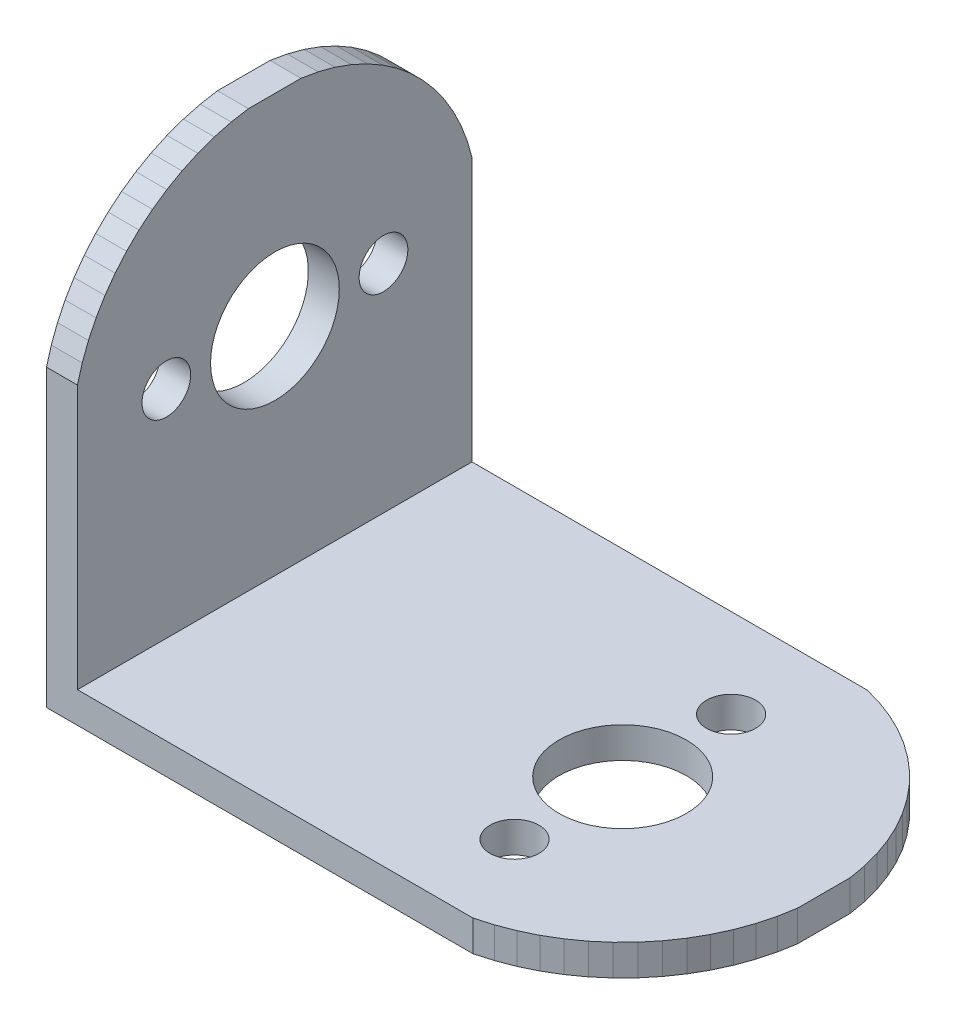
from build123d import *

# Parameters (mm, degrees)
SALIENTE_EXTRUIR1_DEPTH = 2.000000328
CROQUIS2_W              = 2.000000328
CROQUIS2_H              = 25.499995797
SALIENTE_EXTRUIR2_DEPTH = 17.052894691
SALIENTE_EXTRUIR3_DEPTH = 2.000000095
CORTAR_EXTRUIR1_DEPTH   = 92.062133489
CORTAR_EXTRUIR2_DEPTH   = 92.062133489
CORTAR_EXTRUIR3_DEPTH   = 85.413414633
CORTAR_EXTRUIR4_DEPTH   = 85.413414633
CORTAR_EXTRUIR5_DEPTH   = 85.413414633
CORTAR_EXTRUIR6_DEPTH   = 91.256922872
CROQUIS10_R             = 4.160635969
CROQUIS10_R_2           = 1.574242088
CORTAR_EXTRUIR7_DEPTH   = 92.062133489
CROQUIS11_R             = 4.116064073
CROQUIS11_R_2           = 1.582596422
CORTAR_EXTRUIR8_DEPTH   = 86.074229775


with BuildPart() as part:
    # Croquis1 → Saliente-Extruir1 (new body)
    with BuildSketch(Plane(origin=(-18.750000745, 0, 0), x_dir=(0, -1, 0), z_dir=(-1, 0, 0))):
        Polygon((-19.052894786, -77.749997377), (-19.052894786, -52.25000158), (-20.138457417, -52.559908479), (-21.193336695, -52.962061018), (-22.209705785, -53.453475237), (-23.180030286, -54.030507803), (-24.097116664, -54.688870907), (-24.954162538, -55.423695594), (-25.744814426, -56.229524314), (-26.46320872, -57.100389153), (-27.104021981, -58.029823005), (-27.662498876, -59.010945261), (-28.134498745, -60.036472976), (-28.51652354, -61.098802835), (-28.805738315, -62.190063298), (-28.999999166, -63.302159309), (-28.999999166, -66.697835922), (-28.805738315, -67.809939384), (-28.51652354, -68.901196122), (-28.134498745, -69.963529706), (-27.662498876, -70.989057422), (-27.104021981, -71.970179677), (-26.46320872, -72.899609804), (-25.744814426, -73.770478368), (-24.954162538, -74.576310813), (-24.097116664, -75.311124325), (-23.180030286, -75.969494879), (-22.209705785, -76.546527445), (-21.193336695, -77.037930489), (-20.138457417, -77.440083027), align=None)
    extrude(amount=-SALIENTE_EXTRUIR1_DEPTH)

    # Croquis2 → Saliente-Extruir2 (add)
    with BuildSketch(Plane.XZ.offset(-19.052894786)):
        with Locations((-17.750000581, -64.999999479)):
            Rectangle(CROQUIS2_W, CROQUIS2_H)
    extrude(amount=SALIENTE_EXTRUIR2_DEPTH)

    # Croquis3 → Saliente-Extruir3 (add)
    with BuildSketch(Plane.XZ.offset(-2.000000095)):
        Polygon((8.802894503, -77.749997377), (-18.750000745, -77.749997377), (-18.750000745, -52.25000158), (8.802894503, -52.25000158), (9.888458066, -52.559908479), (10.943335481, -52.962061018), (11.959705502, -53.453475237), (12.930030003, -54.030507803), (13.84711545, -54.688870907), (14.704162255, -55.423695594), (15.494815074, -56.229524314), (16.213208437, -57.100389153), (16.854021698, -58.029823005), (17.412498593, -59.010945261), (17.884498462, -60.036472976), (18.266523257, -61.098802835), (18.555738032, -62.190063298), (18.750000745, -63.302159309), (18.750000745, -66.697835922), (18.555738032, -67.809939384), (18.266523257, -68.901196122), (17.884498462, -69.963529706), (17.412498593, -70.989057422), (16.854021698, -71.970179677), (16.213208437, -72.899609804), (15.494815074, -73.770478368), (14.704162255, -74.576310813), (13.84711545, -75.311124325), (12.930030003, -75.969494879), (11.959705502, -76.546527445), (10.943335481, -77.037930489), (9.888458066, -77.440083027), align=None)
    extrude(amount=SALIENTE_EXTRUIR3_DEPTH)

    # Croquis4 → Cortar-Extruir1 (cut, through all)
    with BuildSketch(Plane.ZY.offset(18.750000745)):
        Polygon((-67.884810269, 13.229101896), (-67.402966321, 12.802229263), (-66.858895123, 12.458175421), (-66.266670823, 12.205854058), (-65.641649067, 12.051798403), (-64.999997616, 12.000000104), (-64.358353615, 12.051798403), (-63.733331859, 12.205854058), (-63.141107559, 12.458175421), (-62.597028911, 12.802229263), (-62.115188688, 13.229101896), (-61.708066612, 13.727741316), (-61.386201531, 14.285230078), (-61.157926917, 14.887129888), (-61.029162258, 15.517854132), (-61.003241688, 16.161063686), (-61.08083576, 16.800101846), (-61.259932816, 17.41841808), (-61.535898596, 17.999999225), (-61.901580542, 18.529782072), (-62.347508967, 18.99404265), (-62.86213547, 19.380759448), (-63.432134688, 19.679918885), (-64.04273957, 19.883768633), (-64.678132534, 19.987029955), (-65.321870148, 19.987029955), (-65.957263112, 19.883768633), (-66.567860544, 19.679918885), (-67.137859762, 19.380759448), (-67.652486265, 18.99404265), (-68.098418415, 18.529782072), (-68.464100361, 17.999999225), (-68.740069866, 17.41841808), (-68.919159472, 16.800101846), (-68.996757269, 16.161063686), (-68.970829248, 15.517854132), (-68.842068315, 14.887129888), (-68.613797426, 14.285230078), (-68.291939795, 13.727741316), align=None)
    extrude(amount=-CORTAR_EXTRUIR1_DEPTH, mode=Mode.SUBTRACT)

    # Croquis5 → Cortar-Extruir2 (cut, through all)
    with BuildSketch(Plane.ZY.offset(18.750000745)):
        Polygon((-57.250000536, 14.700962231), (-56.939337403, 14.939339831), (-56.700963527, 15.250000171), (-56.551113725, 15.611771494), (-56.499999017, 16.00000076), (-56.551113725, 16.388230026), (-56.700963527, 16.750000417), (-56.939337403, 17.060659826), (-57.250000536, 17.299037427), (-57.611770928, 17.448889092), (-57.999998331, 17.500000075), (-58.38822946, 17.448889092), (-58.749999851, 17.299037427), (-59.060662985, 17.060659826), (-59.29903686, 16.750000417), (-59.448886663, 16.388230026), (-59.500001371, 16.00000076), (-59.448886663, 15.611771494), (-59.29903686, 15.250000171), (-59.060662985, 14.939339831), (-58.749999851, 14.700962231), (-58.38822946, 14.551111497), (-57.999998331, 14.499999583), (-57.611770928, 14.551111497), align=None)
    extrude(amount=-CORTAR_EXTRUIR2_DEPTH, mode=Mode.SUBTRACT)

    # Croquis6 → Cortar-Extruir3 (cut, through all)
    with BuildSketch(Plane(origin=(0, 2.000000095, 0), x_dir=(-1, 0, 0), z_dir=(0, 1, 0))):
        Polygon((-4.450961947, -57.250000536), (-4.689339548, -56.939337403), (-4.999999888, -56.700963527), (-5.361771677, -56.551113725), (-5.750000011, -56.499999017), (-6.138228346, -56.551113725), (-6.500000134, -56.700963527), (-6.810660474, -56.939337403), (-7.049038075, -57.250000536), (-7.198888808, -57.611770928), (-7.249999791, -57.999998331), (-7.198888808, -58.38822946), (-7.049038075, -58.749999851), (-6.810660474, -59.060662985), (-6.500000134, -59.29903686), (-6.138228346, -59.448886663), (-5.750000011, -59.500001371), (-5.361771677, -59.448886663), (-4.999999888, -59.29903686), (-4.689339548, -59.060662985), (-4.450961947, -58.749999851), (-4.301111214, -58.38822946), (-4.250000231, -57.999998331), (-4.301111214, -57.611770928), align=None)
    extrude(amount=-CORTAR_EXTRUIR3_DEPTH, mode=Mode.SUBTRACT)

    # Croquis7 → Cortar-Extruir4 (cut, through all)
    with BuildSketch(Plane(origin=(0, 2.000000095, 0), x_dir=(-1, 0, 0), z_dir=(0, 1, 0))):
        Polygon((-5.750000011, -73.49999994), (-5.361771677, -73.448888958), (-4.999999888, -73.299042881), (-4.689339548, -73.060661554), (-4.450961947, -72.750002146), (-4.301111214, -72.388231754), (-4.250000231, -71.999996901), (-4.301111214, -71.611769497), (-4.450961947, -71.249999106), (-4.689339548, -70.939339697), (-4.999999888, -70.700958371), (-5.361771677, -70.551112294), (-5.750000011, -70.500001311), (-6.138228346, -70.551112294), (-6.500000134, -70.700958371), (-6.810660474, -70.939339697), (-7.049038075, -71.249999106), (-7.198888808, -71.611769497), (-7.249999791, -71.999996901), (-7.198888808, -72.388231754), (-7.049038075, -72.750002146), (-6.810660474, -73.060661554), (-6.500000134, -73.299042881), (-6.138228346, -73.448888958), align=None)
    extrude(amount=-CORTAR_EXTRUIR4_DEPTH, mode=Mode.SUBTRACT)

    # Croquis8 → Cortar-Extruir5 (cut, through all)
    with BuildSketch(Plane(origin=(0, 2.000000095, 0), x_dir=(-1, 0, 0), z_dir=(0, 1, 0))):
        Polygon((-2.208175836, -63.141107559), (-2.55222898, -62.597028911), (-2.979102544, -62.115188688), (-3.477741033, -61.708066612), (-4.035229795, -61.386201531), (-4.63713007, -61.157926917), (-5.267853383, -61.029162258), (-5.911063869, -61.003241688), (-6.550102495, -61.08083576), (-7.168419193, -61.259932816), (-7.749999873, -61.535898596), (-8.279781789, -61.901580542), (-8.744043298, -62.347508967), (-9.130760096, -62.86213547), (-9.429917671, -63.432134688), (-9.633767419, -64.04273957), (-9.73702874, -64.678132534), (-9.73702874, -65.321870148), (-9.633767419, -65.957263112), (-9.429917671, -66.567860544), (-9.130760096, -67.137859762), (-8.744043298, -67.652486265), (-8.279781789, -68.098418415), (-7.749999873, -68.464100361), (-7.168419193, -68.740069866), (-6.550102495, -68.919159472), (-5.911063869, -68.996757269), (-5.267853383, -68.970829248), (-4.63713007, -68.842068315), (-4.035229795, -68.613797426), (-3.477741033, -68.291939795), (-2.979102544, -67.884810269), (-2.55222898, -67.402966321), (-2.208175836, -66.858895123), (-1.955854241, -66.266670823), (-1.801798935, -65.641649067), (-1.750000054, -64.999997616), (-1.801798935, -64.358353615), (-1.955854241, -63.733331859), align=None)
    extrude(amount=-CORTAR_EXTRUIR5_DEPTH, mode=Mode.SUBTRACT)

    # Croquis9 → Cortar-Extruir6 (cut, through all)
    with BuildSketch(Plane(origin=(-16.750000417, 0, 0), x_dir=(0, 0, -1), z_dir=(1, 0, 0))):
        Polygon((72.750002146, 14.700962231), (73.060661554, 14.939339831), (73.299042881, 15.250000171), (73.448888958, 15.611771494), (73.49999994, 16.00000076), (73.448888958, 16.388230026), (73.299042881, 16.750000417), (73.060661554, 17.060659826), (72.750002146, 17.299037427), (72.388231754, 17.448889092), (71.999996901, 17.500000075), (71.611769497, 17.448889092), (71.249999106, 17.299037427), (70.939339697, 17.060659826), (70.700958371, 16.750000417), (70.551112294, 16.388230026), (70.500001311, 16.00000076), (70.551112294, 15.611771494), (70.700958371, 15.250000171), (70.939339697, 14.939339831), (71.249999106, 14.700962231), (71.611769497, 14.551111497), (71.999996901, 14.499999583), (72.388231754, 14.551111497), align=None)
    extrude(amount=-CORTAR_EXTRUIR6_DEPTH, mode=Mode.SUBTRACT)

    # Croquis10 → Cortar-Extruir7 (cut, through all)
    with BuildSketch(Plane.ZY.offset(18.750000745)):
        with Locations((-65.013688685, 15.96331425)):
            Circle(CROQUIS10_R)
        with Locations((-57.995421153, 15.96331425)):
            Circle(CROQUIS10_R_2)
        with Locations(Location((-72.031956216, 15.96331425, 0), (0, 0, 180))):
            Circle(CROQUIS10_R_2)
    extrude(amount=-CORTAR_EXTRUIR7_DEPTH, mode=Mode.SUBTRACT)

    # Croquis11 → Cortar-Extruir8 (cut, through all)
    with BuildSketch(Plane.XZ):
        with Locations(Location((5.743514397, -64.999997616, 0), (0, 0, 270))):
            Circle(CROQUIS11_R)
        with Locations(Location((5.750000011, -57.999998331, 0), (0, 0, 270))):
            Circle(CROQUIS11_R_2)
        with Locations(Location((5.750000011, -71.999996901, 0), (0, 0, 270))):
            Circle(CROQUIS11_R_2)
    extrude(amount=-CORTAR_EXTRUIR8_DEPTH, mode=Mode.SUBTRACT)


solid = part.part
